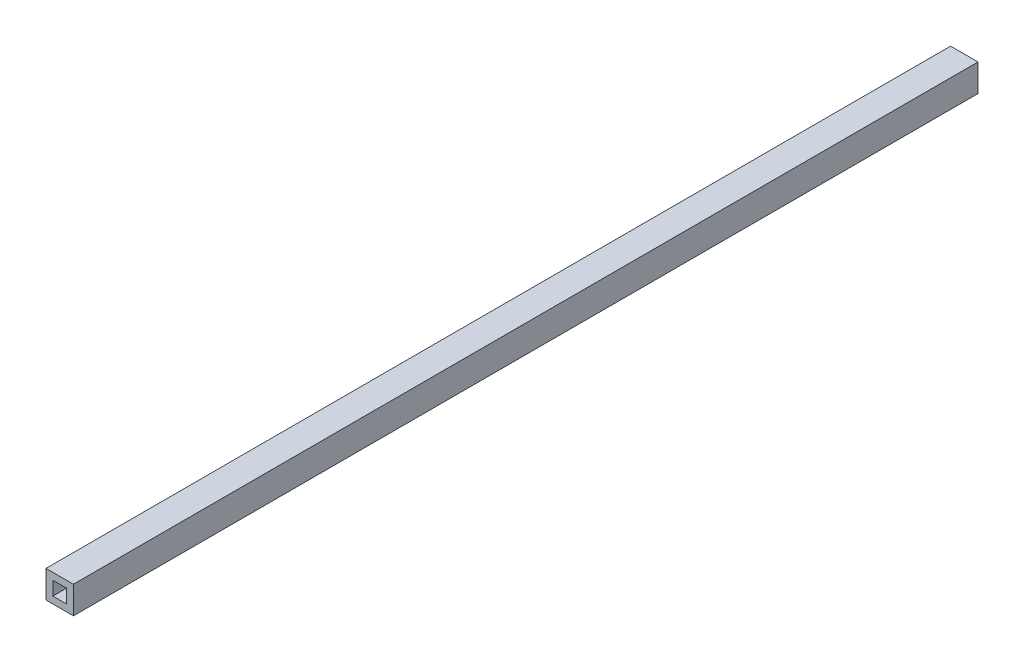
from build123d import *

# Parameters (mm, degrees)
SKETCH1_W           = 20
SKETCH1_H           = 20
SKETCH1_W_2         = 10
SKETCH1_H_2         = 10
EXTRUDE_THIN1_DEPTH = 660


with BuildPart() as part:
    # Sketch1 → Extrude-Thin1 (new body)
    with BuildSketch(Plane.XY):
        Rectangle(SKETCH1_W, SKETCH1_H)
        Rectangle(SKETCH1_W_2, SKETCH1_H_2, mode=Mode.SUBTRACT)
    extrude(amount=EXTRUDE_THIN1_DEPTH)


solid = part.part
